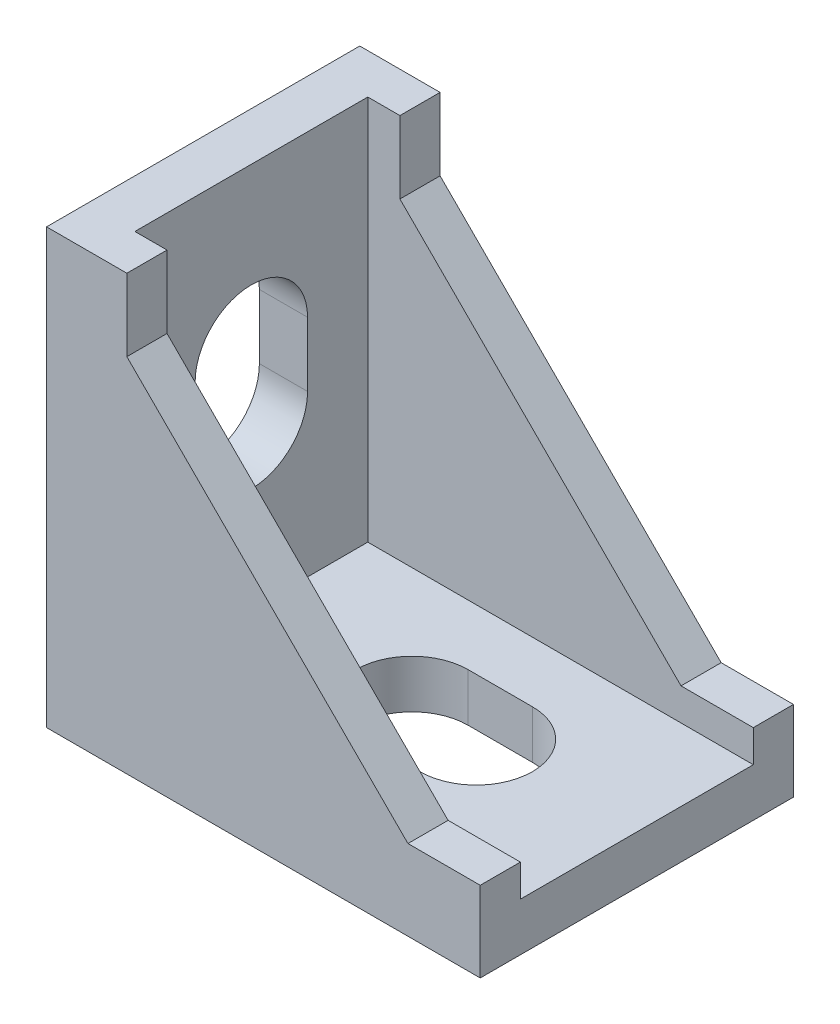
from build123d import *

# Parameters (mm, degrees)
BOSS_EXTRUDE1_DEPTH = 19.5
CUT_EXTRUDE2_DEPTH  = 14.5
CUT_EXTRUDE3_DEPTH  = 42.05179655
CUT_EXTRUDE4_DEPTH  = 42.05179655


with BuildPart() as part:
    # Sketch1 → Boss-Extrude1 (new body)
    with BuildSketch(Plane.XY):
        Polygon((0, 0), (0, 27), (5, 27), (5, 22.5), (22.5, 5), (27, 5), (27, 0), align=None)
    extrude(amount=BOSS_EXTRUDE1_DEPTH)

    # Sketch2 → Cut-Extrude2 (cut)
    with BuildSketch(Plane.XY.offset(17)):
        Polygon((3, 27), (5, 27), (5, 22.5), (22.5, 5), (27, 5), (27, 3), (3, 3), align=None)
    extrude(amount=-CUT_EXTRUDE2_DEPTH, mode=Mode.SUBTRACT)

    # Sketch3 → Cut-Extrude3 (cut, through all)
    with BuildSketch(Plane(origin=(0, 3, 0), x_dir=(1, 0, 0), z_dir=(0, 1, 0))):
        with BuildLine():
            Line((13, -6.25), (17, -6.25))
            ThreePointArc((17, -6.25), (20.5, -9.75), (17, -13.25))
            Line((17, -13.25), (13, -13.25))
            ThreePointArc((13, -13.25), (9.5, -9.75), (13, -6.25))
        make_face()
    extrude(amount=-CUT_EXTRUDE3_DEPTH, mode=Mode.SUBTRACT)

    # Sketch4 → Cut-Extrude4 (cut, through all)
    with BuildSketch(Plane(origin=(3, 0, 0), x_dir=(0, 0, -1), z_dir=(1, 0, 0))):
        with BuildLine():
            Line((-13.25, 13), (-13.25, 17))
            ThreePointArc((-13.25, 17), (-9.75, 20.5), (-6.25, 17))
            Line((-6.25, 17), (-6.25, 13))
            ThreePointArc((-6.25, 13), (-9.75, 9.5), (-13.25, 13))
        make_face()
    extrude(amount=-CUT_EXTRUDE4_DEPTH, mode=Mode.SUBTRACT)


solid = part.part
